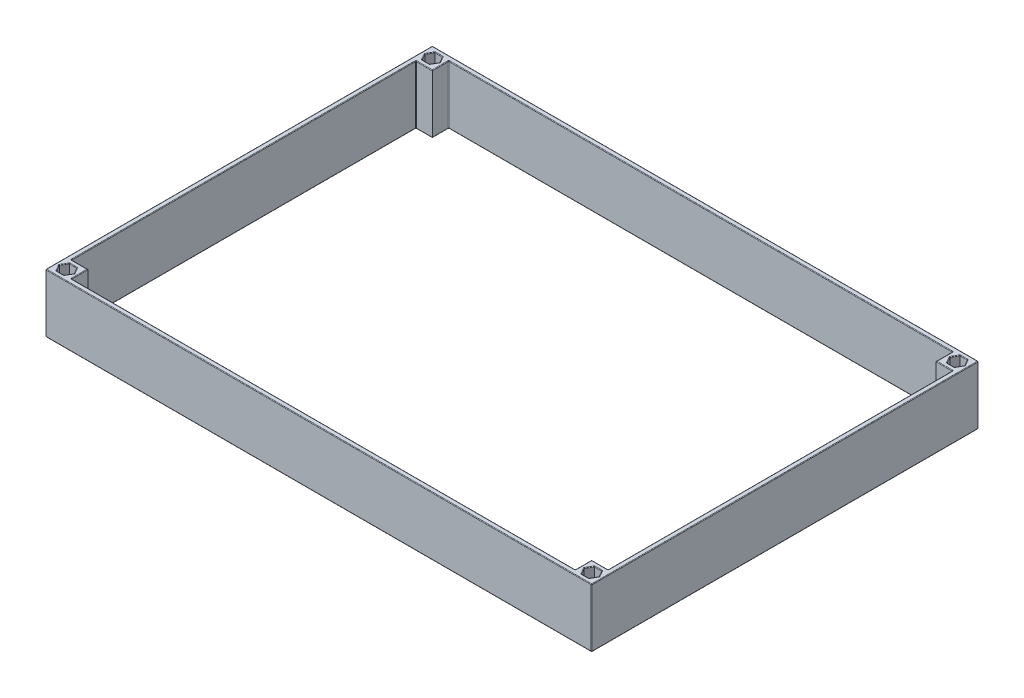
from build123d import *

# Parameters (mm, degrees)
SKETCH1_W           = 233
SKETCH1_H           = 165
BOSS_EXTRUDE1_DEPTH = 5
SKETCH1_3_W         = 2
SKETCH1_3_H         = 147
SKETCH1_3_W_2       = 215
SKETCH1_3_H_2       = 2
SKETCH1_3_R         = 1.75
BOSS_EXTRUDE3_DEPTH = 20
FILLET1_R           = 0.25


with BuildPart() as part:
    # Sketch1 → Boss-Extrude1 (new body)
    with BuildSketch(Plane(origin=(0, 0, 0), x_dir=(1, 0, 0), z_dir=(0, 1, 0))):
        with Locations((116.5, 82.5)):
            Rectangle(SKETCH1_W, SKETCH1_H)
        Polygon((231, 9), (224, 9), (224, 2), (9, 2), (9, 9), (2, 9), (2, 156), (9, 156), (9, 163), (224, 163), (224, 156), (231, 156), align=None, mode=Mode.SUBTRACT)
        Polygon((6.08771324, 163.25), (7.675426481, 160.5), (6.08771324, 157.75), (2.91228676, 157.75), (1.324573519, 160.5), (2.91228676, 163.25), align=None, mode=Mode.SUBTRACT)
        Polygon((7.675426481, 4.5), (6.08771324, 1.75), (2.91228676, 1.75), (1.324573519, 4.5), (2.91228676, 7.25), (6.08771324, 7.25), align=None, mode=Mode.SUBTRACT)
        Polygon((231.675426481, 160.5), (230.08771324, 157.75), (226.91228676, 157.75), (225.324573519, 160.5), (226.91228676, 163.25), (230.08771324, 163.25), align=None, mode=Mode.SUBTRACT)
        Polygon((231.675426481, 4.5), (230.08771324, 1.75), (226.91228676, 1.75), (225.324573519, 4.5), (226.91228676, 7.25), (230.08771324, 7.25), align=None, mode=Mode.SUBTRACT)
    extrude(amount=BOSS_EXTRUDE1_DEPTH)

    # Sketch1<3> → Boss-Extrude3 (add)
    # profile 1 of 12: a face of its own
    with BuildSketch(Plane(origin=(0, 0, 0), x_dir=(1, 0, 0), z_dir=(0, 1, 0))):
        with Locations((232, 82.5)):
            Rectangle(SKETCH1_3_W, SKETCH1_3_H)
    # profile 2 of 12: a face of its own
    with BuildSketch(Plane(origin=(0, 0, 0), x_dir=(1, 0, 0), z_dir=(0, 1, 0))):
        Polygon((233, 165), (224, 165), (224, 163), (224, 156), (231, 156), (233, 156), align=None)
        Polygon((230.08771324, 163.25), (231.675426481, 160.5), (230.08771324, 157.75), (226.91228676, 157.75), (225.324573519, 160.5), (226.91228676, 163.25), align=None, mode=Mode.SUBTRACT)
    # profile 3 of 12: a face of its own
    with BuildSketch(Plane(origin=(0, 0, 0), x_dir=(1, 0, 0), z_dir=(0, 1, 0))):
        with Locations((116.5, 164)):
            Rectangle(SKETCH1_3_W_2, SKETCH1_3_H_2)
    # profile 4 of 12: a face of its own
    with BuildSketch(Plane(origin=(0, 0, 0), x_dir=(1, 0, 0), z_dir=(0, 1, 0))):
        Polygon((0, 165), (0, 156), (2, 156), (9, 156), (9, 163), (9, 165), align=None)
        Polygon((6.08771324, 163.25), (7.675426481, 160.5), (6.08771324, 157.75), (2.91228676, 157.75), (1.324573519, 160.5), (2.91228676, 163.25), align=None, mode=Mode.SUBTRACT)
    # profile 5 of 12: a face of its own
    with BuildSketch(Plane(origin=(0, 0, 0), x_dir=(1, 0, 0), z_dir=(0, 1, 0))):
        Polygon((2.91228676, 157.75), (6.08771324, 157.75), (7.675426481, 160.5), (6.08771324, 163.25), (2.91228676, 163.25), (1.324573519, 160.5), align=None)
        with Locations(Location((4.5, 160.5, 0), (0, 0, 270))):
            Circle(SKETCH1_3_R, mode=Mode.SUBTRACT)
    # profile 6 of 12: a face of its own
    with BuildSketch(Plane(origin=(0, 0, 0), x_dir=(1, 0, 0), z_dir=(0, 1, 0))):
        with Locations((1, 82.5)):
            Rectangle(SKETCH1_3_W, SKETCH1_3_H)
    # profile 7 of 12: a face of its own
    with BuildSketch(Plane(origin=(0, 0, 0), x_dir=(1, 0, 0), z_dir=(0, 1, 0))):
        Polygon((226.91228676, 157.75), (230.08771324, 157.75), (231.675426481, 160.5), (230.08771324, 163.25), (226.91228676, 163.25), (225.324573519, 160.5), align=None)
        with Locations(Location((228.5, 160.5, 0), (0, 0, 270))):
            Circle(SKETCH1_3_R, mode=Mode.SUBTRACT)
    # profile 8 of 12: a face of its own
    with BuildSketch(Plane(origin=(0, 0, 0), x_dir=(1, 0, 0), z_dir=(0, 1, 0))):
        Polygon((224, 2), (224, 0), (233, 0), (233, 9), (231, 9), (224, 9), align=None)
        Polygon((230.08771324, 7.25), (231.675426481, 4.5), (230.08771324, 1.75), (226.91228676, 1.75), (225.324573519, 4.5), (226.91228676, 7.25), align=None, mode=Mode.SUBTRACT)
    # profile 9 of 12: a face of its own
    with BuildSketch(Plane(origin=(0, 0, 0), x_dir=(1, 0, 0), z_dir=(0, 1, 0))):
        Polygon((226.91228676, 1.75), (230.08771324, 1.75), (231.675426481, 4.5), (230.08771324, 7.25), (226.91228676, 7.25), (225.324573519, 4.5), align=None)
        with Locations(Location((228.5, 4.5, 0), (0, 0, 270))):
            Circle(SKETCH1_3_R, mode=Mode.SUBTRACT)
    # profile 10 of 12: a face of its own
    with BuildSketch(Plane(origin=(0, 0, 0), x_dir=(1, 0, 0), z_dir=(0, 1, 0))):
        with Locations((116.5, 1)):
            Rectangle(SKETCH1_3_W_2, SKETCH1_3_H_2)
    # profile 11 of 12: a face of its own
    with BuildSketch(Plane(origin=(0, 0, 0), x_dir=(1, 0, 0), z_dir=(0, 1, 0))):
        Polygon((2, 9), (0, 9), (0, 0), (9, 0), (9, 2), (9, 9), align=None)
        Polygon((6.08771324, 7.25), (7.675426481, 4.5), (6.08771324, 1.75), (2.91228676, 1.75), (1.324573519, 4.5), (2.91228676, 7.25), align=None, mode=Mode.SUBTRACT)
    # profile 12 of 12: a face of its own
    with BuildSketch(Plane(origin=(0, 0, 0), x_dir=(1, 0, 0), z_dir=(0, 1, 0))):
        Polygon((2.91228676, 1.75), (6.08771324, 1.75), (7.675426481, 4.5), (6.08771324, 7.25), (2.91228676, 7.25), (1.324573519, 4.5), align=None)
        with Locations(Location((4.5, 4.5, 0), (0, 0, 270))):
            Circle(SKETCH1_3_R, mode=Mode.SUBTRACT)
    extrude(amount=-BOSS_EXTRUDE3_DEPTH)

    # Fillet1
    fillet1_edges = [part.edges().sort_by_distance(p)[0] for p in [
        (224, 5, -5.5),
        (116.5, 5, 0),
        (233, 5, -82.5),
        (116.5, 5, -165),
        (0, 5, -82.5),
        (230.88156986, 5, -159.125),
        (116.5, -20, 0),
        (0, -20, -82.5),
        (228.5, 5, -157.75),
        (9, -20, -159.5),
        (5.5, -20, -156),
        (2, -20, -82.5),
        (5.5, -20, -9),
        (9, -20, -5.5),
        (226.11843014, 5, -159.125),
        (116.5, -20, -2),
        (224, -20, -5.5),
        (227.5, -20, -9),
        (231, -20, -82.5),
        (227.5, -20, -156),
        (224, -20, -159.5),
        (116.5, -20, -163),
        (233, -20, -82.5),
        (116.5, -20, -165),
        (228.5, -20, -6.25),
        (228.5, -20, -162.25),
        (4.5, -20, -6.25),
        (4.5, -20, -162.25),
        (226.11843014, 5, -161.875),
        (228.5, 5, -163.25),
        (116.5, 5, -2),
        (230.88156986, 5, -161.875),
        (6.88156986, 5, -3.125),
        (4.5, 5, -1.75),
        (2.11843014, 5, -3.125),
        (2.11843014, 5, -5.875),
        (4.5, 5, -7.25),
        (6.88156986, 5, -5.875),
        (230.88156986, 5, -3.125),
        (228.5, 5, -1.75),
        (226.11843014, 5, -3.125),
        (9, 5, -5.5),
        (226.11843014, 5, -5.875),
        (228.5, 5, -7.25),
        (230.88156986, 5, -5.875),
        (5.5, 5, -9),
        (2, 5, -82.5),
        (5.5, 5, -156),
        (9, 5, -159.5),
        (116.5, 5, -163),
        (224, 5, -159.5),
        (227.5, 5, -156),
        (231, 5, -82.5),
        (227.5, 5, -9),
        (6.88156986, 5, -159.125),
        (4.5, 5, -157.75),
        (0, -7.5, 0),
        (0, -7.5, -165),
        (233, -7.5, -165),
        (233, -7.5, 0),
        (2.11843014, 5, -159.125),
        (231, -7.5, -9),
        (231, -7.5, -156),
        (224, -7.5, -163),
        (9, -7.5, -163),
        (2, -7.5, -156),
        (2, -7.5, -9),
        (9, -7.5, -2),
        (224, -7.5, -2),
        (2.11843014, 5, -161.875),
        (4.5, 5, -163.25),
        (6.88156986, 5, -161.875),
    ]]
    fillet(fillet1_edges, radius=FILLET1_R)


solid = part.part
